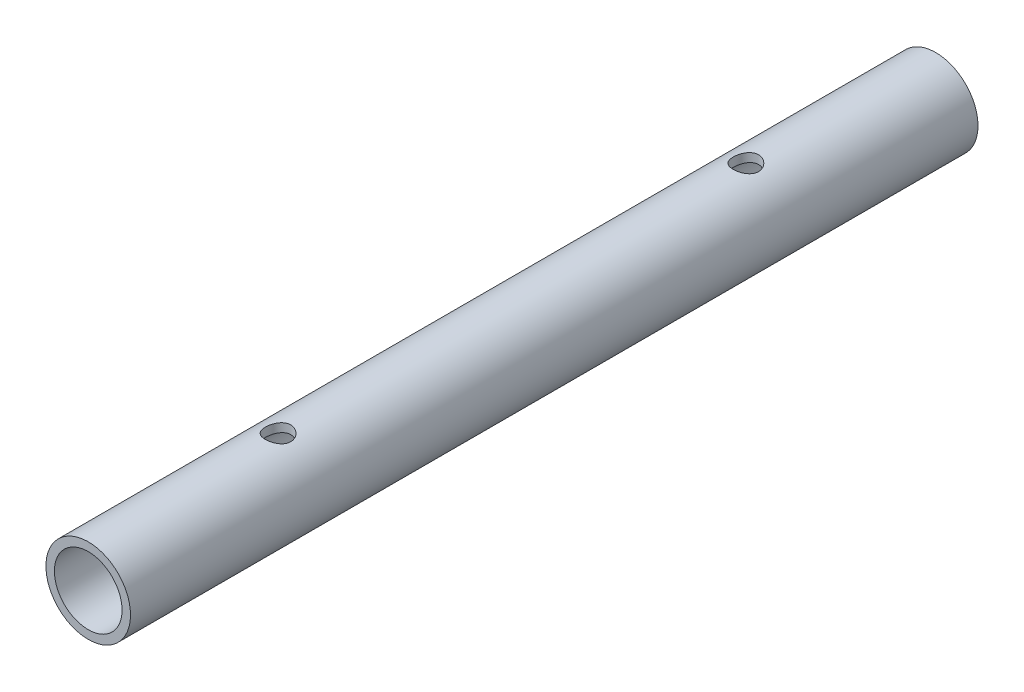
from build123d import *

# Parameters (mm, degrees)
SKETCH1_R               = 5
BOSS_EXTRUDE1_DEPTH     = 100.19
CUT_EXTRUDE1_REACH      = 102.439
SKETCH2_R               = 4
CUT_EXTRUDE2_DEPTH      = 101.439215947
CUT_EXTRUDE2_DEPTH_BACK = 101.439215947
SKETCH5_R               = 1.5


with BuildPart() as part:
    # Sketch1 → Boss-Extrude1 (new body)
    with BuildSketch(Plane.XY):
        Circle(SKETCH1_R)
    extrude(amount=BOSS_EXTRUDE1_DEPTH)

    # Sketch2 → Cut-Extrude1 (cut, up to next)
    with BuildSketch(Plane.XY.offset(100.19), mode=Mode.PRIVATE) as cut_extrude1_sk1:
        Circle(SKETCH2_R)
    cut_extrude1_tool1 = extrude(cut_extrude1_sk1.sketch, amount=-CUT_EXTRUDE1_REACH, mode=Mode.PRIVATE) & part.part
    add(cut_extrude1_tool1.solids().sort_by_distance((0, 0, 100.19))[0], mode=Mode.SUBTRACT)

    # Sketch5 → Cut-Extrude2 (cut, two sides: drawn at the far end of the back side and taken through both)
    with BuildSketch(Plane(origin=(0, 0, 0), x_dir=(1, 0, 0), z_dir=(0, 1, 0)).offset(-CUT_EXTRUDE2_DEPTH_BACK)):
        with Locations(Location((0, -22.443, 0), (0, 0, 270))):
            Circle(SKETCH5_R)
        with Locations(Location((0, -77.748, 0), (0, 0, 270))):
            Circle(SKETCH5_R)
    extrude(amount=CUT_EXTRUDE2_DEPTH + CUT_EXTRUDE2_DEPTH_BACK, mode=Mode.SUBTRACT)


solid = part.part
